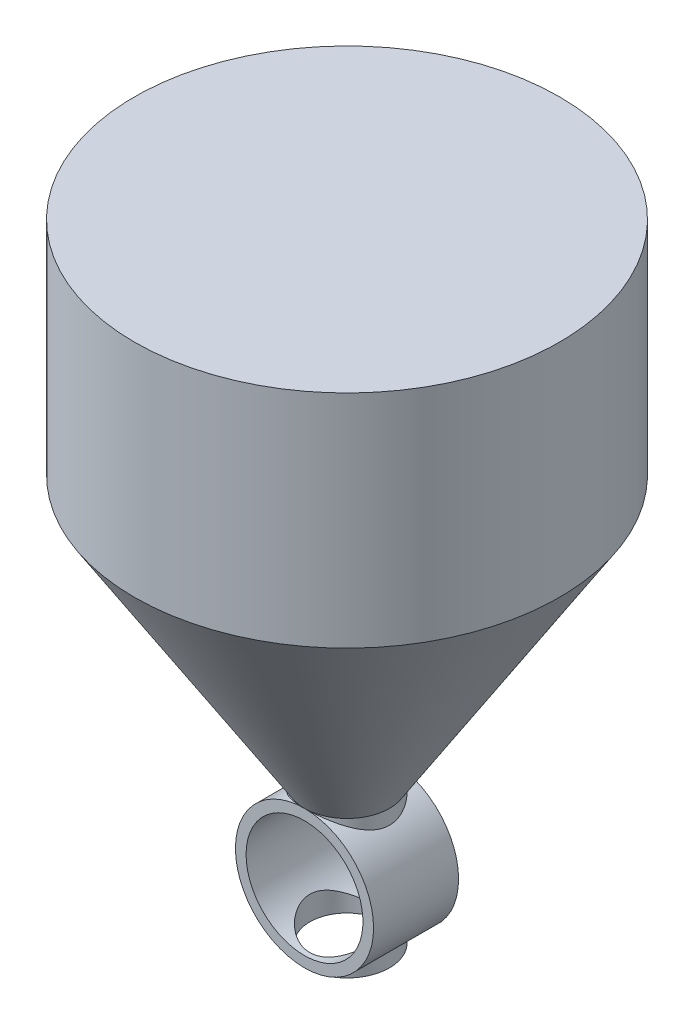
from build123d import *

# Parameters (mm, degrees)
CROQUIS1_R              = 100
SALIENTE_EXTRUIR1_DEPTH = 104
CROQUIS3_R              = 20
CROQUIS2_R              = 100
CROQUIS4_R              = 20
SALIENTE_EXTRUIR2_DEPTH = 65
CROQUIS5_R              = 32.5
SALIENTE_EXTRUIR3_DEPTH = 40
CROQUIS6_R              = 27.5
CORTAR_EXTRUIR1_DEPTH   = 334.803834764
CROQUIS7_R              = 17.5
CORTAR_EXTRUIR2_DEPTH   = 24


with BuildPart() as part:
    # Croquis1 → Saliente-Extruir1 (new body)
    with BuildSketch(Plane(origin=(0, 0, 0), x_dir=(1, 0, 0), z_dir=(0, 1, 0))):
        with Locations(Location((0, 0, 0), (0, 0, 270))):
            Circle(CROQUIS1_R)
    extrude(amount=-SALIENTE_EXTRUIR1_DEPTH)

    # Croquis3 → Recubrir1 section 0
    with BuildSketch(Plane(origin=(0, -230, 0), x_dir=(1, 0, 0), z_dir=(0, 1, 0))):
        Circle(CROQUIS3_R)
    # Croquis2 → Recubrir1 section 1
    with BuildSketch(Plane.XZ.offset(104)):
        Circle(CROQUIS2_R)
    loft()

    # Croquis4 → Saliente-Extruir2 (add)
    with BuildSketch(Plane.XZ.offset(230)):
        with Locations(Location((0, 0, 0), (0, 0, 270))):
            Circle(CROQUIS4_R)
    extrude(amount=SALIENTE_EXTRUIR2_DEPTH)

    # Croquis5 → Saliente-Extruir3 (add)
    with BuildSketch(Plane(origin=(0, 0, -20), x_dir=(-1, 0, 0), z_dir=(0, 0, -1))):
        with Locations((0, -262.5)):
            Circle(CROQUIS5_R)
    extrude(amount=-SALIENTE_EXTRUIR3_DEPTH)

    # Croquis6 → Cortar-Extruir1 (cut, through all)
    with BuildSketch(Plane(origin=(0, 0, -20), x_dir=(-1, 0, 0), z_dir=(0, 0, -1))):
        with Locations((0, -262.5)):
            Circle(CROQUIS6_R)
    extrude(amount=-CORTAR_EXTRUIR1_DEPTH, mode=Mode.SUBTRACT)

    # Croquis7 → Cortar-Extruir2 (cut)
    with BuildSketch(Plane.XZ.offset(295)):
        with Locations(Location((0, 0, 0), (0, 0, 270))):
            Circle(CROQUIS7_R)
    extrude(amount=-CORTAR_EXTRUIR2_DEPTH, mode=Mode.SUBTRACT)


solid = part.part
